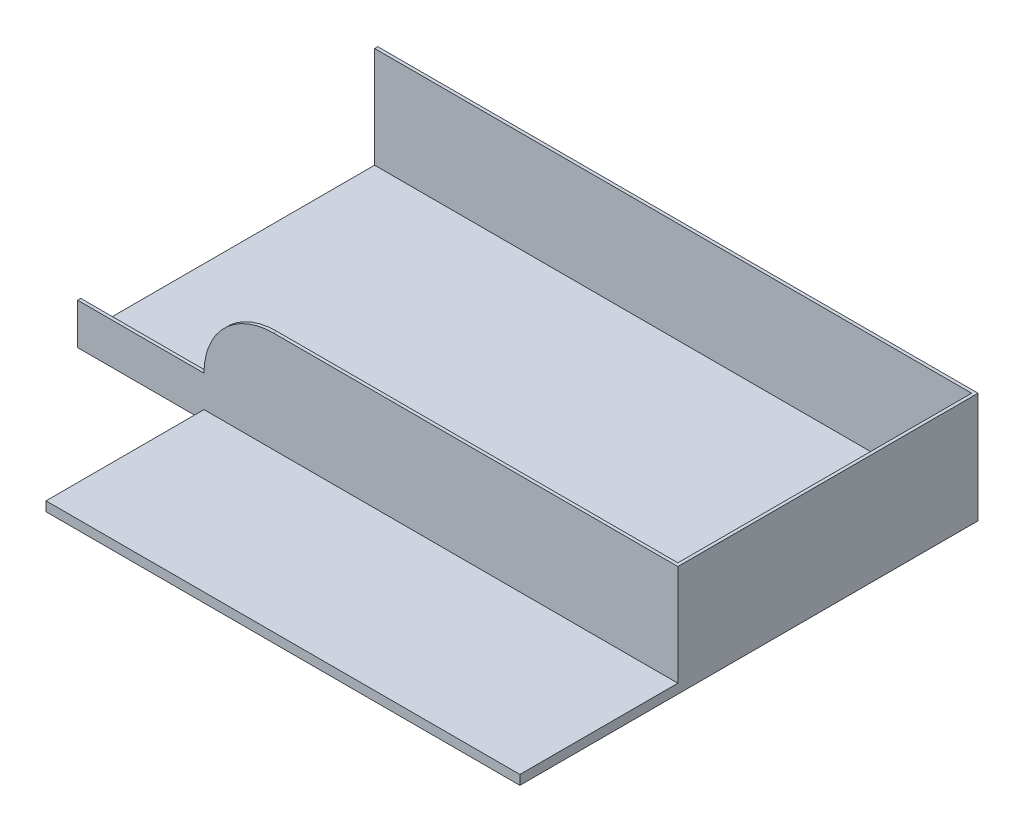
from build123d import *

# Parameters (mm, degrees)
SKETCH1_W           = 1900
SKETCH1_H           = 950
BOSS_EXTRUDE1_DEPTH = 30
BOSS_EXTRUDE2_DEPTH = 350
BOSS_EXTRUDE4_DEPTH = 30
BOSS_EXTRUDE5_DEPTH = 10


with BuildPart() as part:
    # Sketch1 → Boss-Extrude1 (new body)
    with BuildSketch(Plane(origin=(0, 0, 0), x_dir=(1, 0, 0), z_dir=(0, 1, 0))):
        with Locations((950, -475)):
            Rectangle(SKETCH1_W, SKETCH1_H)
    extrude(amount=BOSS_EXTRUDE1_DEPTH)

    # Sketch1<3> → Boss-Extrude2 (add)
    with BuildSketch(Plane(origin=(0, 0, 0), x_dir=(1, 0, 0), z_dir=(0, 1, 0))):
        Polygon((0, 0), (0, -10), (1890, -10), (1890, -950), (1900, -950), (1900, 0), align=None)
    extrude(amount=BOSS_EXTRUDE2_DEPTH)

    # Sketch1<4> → Boss-Extrude4 (add)
    with BuildSketch(Plane(origin=(0, 0, 0), x_dir=(1, 0, 0), z_dir=(0, 1, 0))):
        Polygon((1900, -950), (1890, -950), (400, -950), (400, -1450), (1900, -1450), align=None)
    extrude(amount=BOSS_EXTRUDE4_DEPTH)

    # Sketch3 → Boss-Extrude5 (add)
    with BuildSketch(Plane.XY.offset(950)):
        with BuildLine():
            ThreePointArc((620, 350), (464.436508139, 285.563491861), (400, 130))
            Line((400, 130), (0, 130))
            Line((0, 130), (0, 30))
            Line((0, 30), (1900, 30))
            Line((1900, 30), (1900, 350))
            Line((1900, 350), (620, 350))
        make_face()
    extrude(amount=-BOSS_EXTRUDE5_DEPTH)


solid = part.part
